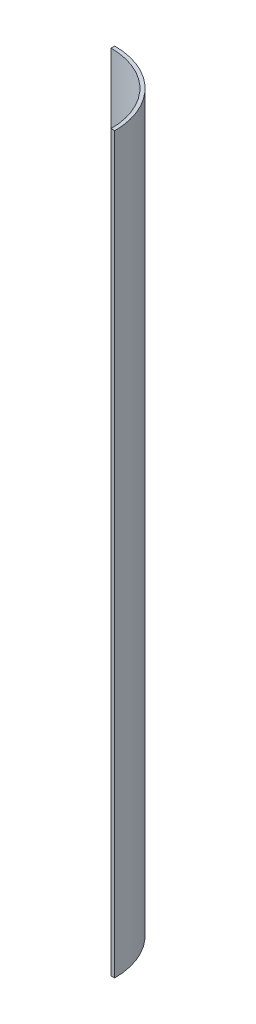
from build123d import *

# Parameters (mm, degrees)
BOSS_EXTRUDE2_DEPTH = 254


with BuildPart() as part:
    # Sketch1 → Boss-Extrude2 (new body)
    with BuildSketch(Plane(origin=(0, 0, 0), x_dir=(1, 0, 0), z_dir=(0, 1, 0))):
        with BuildLine():
            Line((0, 24.13), (0, 25.4))
            ThreePointArc((0, 25.4), (17.960512242, 17.960512242), (25.4, 0))
            Line((25.4, 0), (24.13, 0))
            ThreePointArc((24.13, 0), (17.06248663, 17.06248663), (0, 24.13))
        make_face()
    extrude(amount=BOSS_EXTRUDE2_DEPTH)


solid = part.part
